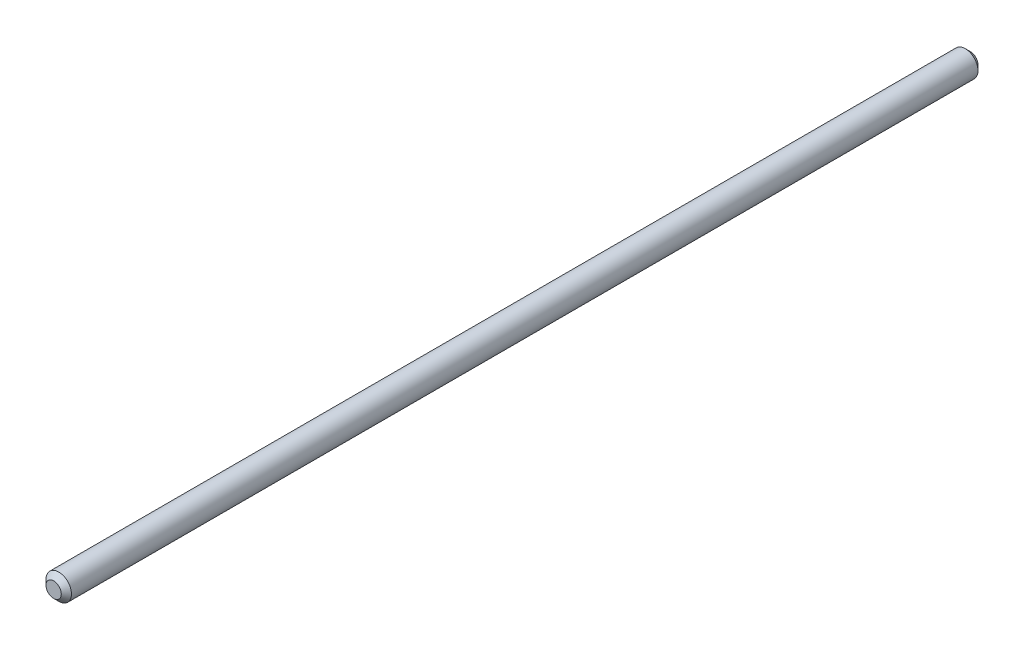
from build123d import *

# Parameters (mm, degrees)
SKETCH1_R           = 1.25
BOSS_EXTRUDE1_DEPTH = 90
CHAMFER1_SIZE       = 0.5
CHAMFER2_SIZE       = 0.5


with BuildPart() as part:
    # Sketch1 → Boss-Extrude1 (new body)
    with BuildSketch(Plane.XY):
        with Locations(Location((0, 0, 0), (0, 0, 180))):
            Circle(SKETCH1_R)
    extrude(amount=BOSS_EXTRUDE1_DEPTH)

    # Chamfer1
    chamfer1_edges = [part.edges().sort_by_distance(p)[0] for p in [
        (1.25, 0, 0),
    ]]
    chamfer(chamfer1_edges, length=CHAMFER1_SIZE)

    # Chamfer2
    chamfer2_edges = [part.edges().sort_by_distance(p)[0] for p in [
        (1.25, 0, 90),
    ]]
    chamfer(chamfer2_edges, length=CHAMFER2_SIZE)


solid = part.part
